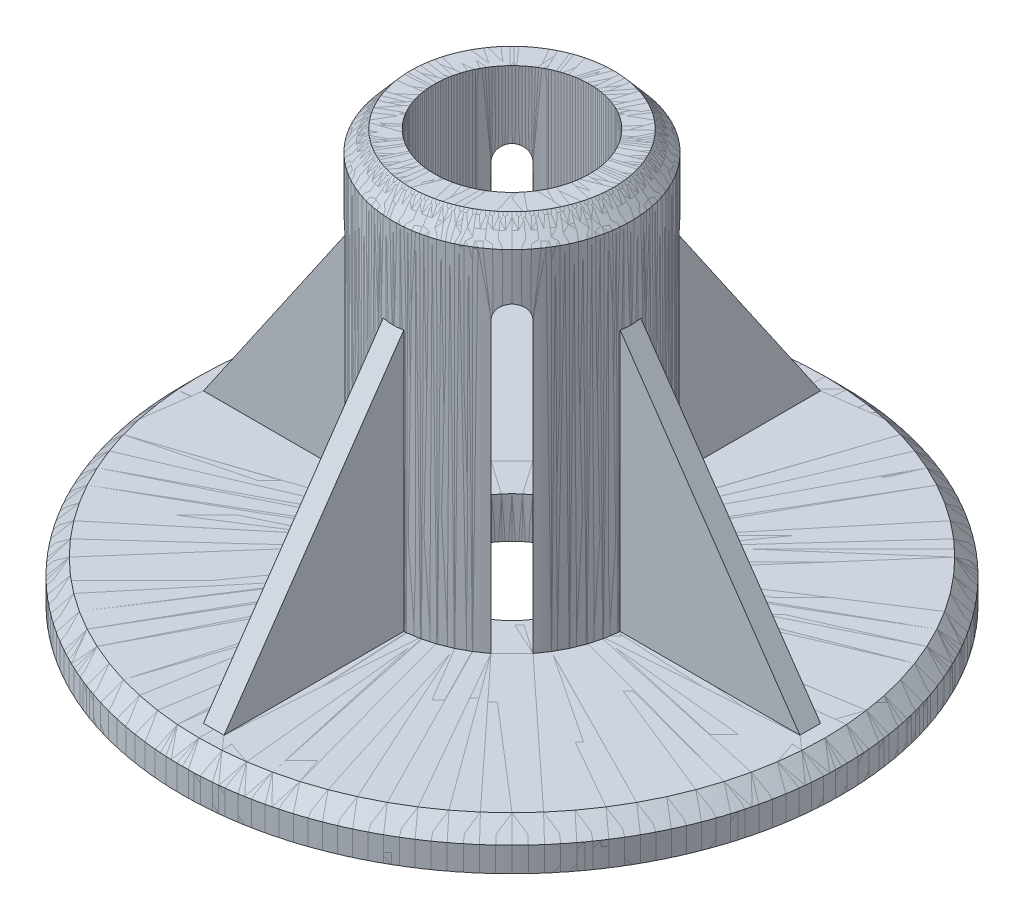
from build123d import *

# Parameters (mm, degrees)
RIB2_REACH         = 97.883
SKETCH2_WALL_W     = 242.495204264
SKETCH2_WALL_H     = 3.175
CIRPATTERN1_COUNT  = 4
CUT_EXTRUDE2_DEPTH = 111.290112951
CUT_EXTRUDE3_DEPTH = 111.290113009


with BuildPart() as part:
    # Sketch1 → Revolve1 (revolve)
    with BuildSketch(Plane.XY, mode=Mode.PRIVATE) as revolve1_sk:
        Polygon((11.983662921, 63.5), (15.622187352, 63.5), (18.333662921, 60.356576106), (18.333662921, 6.35), (48.26, 6.35), (50.8, 3.81), (50.8, 0), (11.983662921, 0), align=None)
    revolve(revolve1_sk.sketch.rotate(Axis((0, 0, 0), (0, 1, 0)), 90), axis=Axis((0, 0, 0), (0, 1, 0)))

    # Sketch2 wall → Rib2 (add, up to next)
    with BuildSketch(Plane(origin=(32.150687385, 26.418100936, 0), x_dir=(0.567091806558, -0.823654589579, 0), z_dir=(0.823654589579, 0.567091806558, 0)), mode=Mode.PRIVATE) as rib2_sk1:
        Rectangle(SKETCH2_WALL_W, SKETCH2_WALL_H)
    rib2_tool1 = extrude(rib2_sk1.sketch, amount=-RIB2_REACH, mode=Mode.PRIVATE) - part.part
    add(rib2_tool1.solids().sort_by_distance((32.150687385, 26.418100936, 0))[0])


with BuildPart() as cirpattern1_1:
    # CirPattern1: pattern copy
    add(part.part.rotate(Axis((0, 0, 0), (0, 1, 0)), 1 * 360 / CIRPATTERN1_COUNT))


with BuildPart() as cirpattern1_2:
    # CirPattern1: pattern copy
    add(part.part.rotate(Axis((0, 0, 0), (0, 1, 0)), 2 * 360 / CIRPATTERN1_COUNT))


with BuildPart() as cirpattern1_3:
    # CirPattern1: pattern copy
    add(part.part.rotate(Axis((0, 0, 0), (0, 1, 0)), 3 * 360 / CIRPATTERN1_COUNT))


with BuildPart() as cut_extrude2_tool:
    # Sketch9 → Cut-Extrude2 (new, through all)
    with BuildSketch(Plane(origin=(12.963857376, 63.5, -12.963857376), x_dir=(-0.707106781186549, 0, -0.707106781186546), z_dir=(0.707106781186546, 0, -0.707106781186549))):
        with BuildLine():
            Line((-2.032, -12.7), (-2.032, -57.15))
            Line((-2.032, -57.15), (2.032, -57.15))
            Line((2.032, -57.15), (2.032, -12.7))
            ThreePointArc((2.032, -12.7), (0, -10.668), (-2.032, -12.7))
        make_face()
    extrude(amount=-CUT_EXTRUDE2_DEPTH)


with BuildPart() as part_1:
    add(part.part)

    # Cut-Extrude2: cut by cut_extrude2_tool
    add(cut_extrude2_tool.part, mode=Mode.SUBTRACT)


with BuildPart() as cirpattern1_1_1:
    add(cirpattern1_1.part)

    # Cut-Extrude2: cut by cut_extrude2_tool
    add(cut_extrude2_tool.part, mode=Mode.SUBTRACT)


with BuildPart() as cirpattern1_2_1:
    add(cirpattern1_2.part)

    # Cut-Extrude2: cut by cut_extrude2_tool
    add(cut_extrude2_tool.part, mode=Mode.SUBTRACT)


with BuildPart() as cirpattern1_3_1:
    add(cirpattern1_3.part)

    # Cut-Extrude2: cut by cut_extrude2_tool
    add(cut_extrude2_tool.part, mode=Mode.SUBTRACT)


with BuildPart() as cut_extrude3_tool:
    # Sketch7 → Cut-Extrude3 (new, through all)
    with BuildSketch(Plane(origin=(-12.963857376, 63.5, -12.963857376), x_dir=(-0.7071067811865487, 0, 0.7071067811865465), z_dir=(-0.7071067811865465, 0, -0.7071067811865487))):
        with BuildLine():
            Line((-2.286, -12.7), (-2.286, -57.15))
            Line((-2.286, -57.15), (2.286, -57.15))
            Line((2.286, -57.15), (2.286, -12.7))
            ThreePointArc((2.286, -12.7), (0, -10.414), (-2.286, -12.7))
        make_face()
    extrude(amount=-CUT_EXTRUDE3_DEPTH)


with BuildPart() as part_2:
    add(part_1.part)

    # Cut-Extrude3: cut by cut_extrude3_tool
    add(cut_extrude3_tool.part, mode=Mode.SUBTRACT)


with BuildPart() as cirpattern1_1_2:
    add(cirpattern1_1_1.part)

    # Cut-Extrude3: cut by cut_extrude3_tool
    add(cut_extrude3_tool.part, mode=Mode.SUBTRACT)


with BuildPart() as cirpattern1_2_2:
    add(cirpattern1_2_1.part)

    # Cut-Extrude3: cut by cut_extrude3_tool
    add(cut_extrude3_tool.part, mode=Mode.SUBTRACT)


with BuildPart() as cirpattern1_3_2:
    add(cirpattern1_3_1.part)

    # Cut-Extrude3: cut by cut_extrude3_tool
    add(cut_extrude3_tool.part, mode=Mode.SUBTRACT)


solid = Compound([part_2.part, cirpattern1_1_2.part, cirpattern1_2_2.part, cirpattern1_3_2.part])
